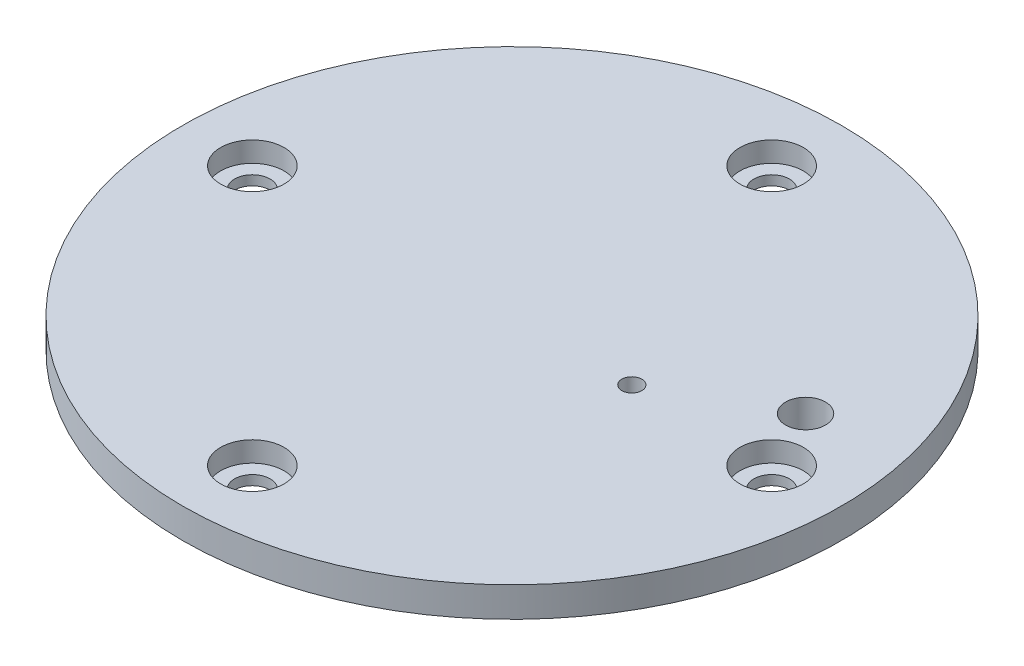
from build123d import *

# Parameters (mm, degrees)
SKETCH1_R                                      = 16.5
BOSS_EXTRUDE1_DEPTH                            = 1.5
CBORE_FOR_0_SOCKET_HEAD_CAP_SCREW1_D           = 1.778
CBORE_FOR_0_SOCKET_HEAD_CAP_SCREW1_CBORE_D     = 3.175
CBORE_FOR_0_SOCKET_HEAD_CAP_SCREW1_CBORE_DEPTH = 1.016
CIRPATTERN1_COUNT                              = 4
SKETCH15_R                                     = 0.5
CUT_EXTRUDE1_DEPTH                             = 1.5
CUT_EXTRUDE2_DEPTH                             = 24.382685902
CUT_EXTRUDE2_DEPTH_BACK                        = 24.382685902
SKETCH16_R                                     = 1


with BuildPart() as part:
    # Sketch1 → Boss-Extrude1 (new body)
    with BuildSketch(Plane(origin=(0, 0, 0), x_dir=(1, 0, 0), z_dir=(0, 1, 0))):
        with Locations(Location((0, 0, 0), (0, 0, 270))):
            Circle(SKETCH1_R)
    extrude(amount=BOSS_EXTRUDE1_DEPTH)

    # CBORE for #0 Socket Head Cap Screw1 (through all)
    with Locations(Plane(origin=(0, 1.5, 0), x_dir=(1, 0, 0), z_dir=(0, 1, 0))):
        with Locations((-13, 0)):
            cbore_for_0_socket_head_cap_screw1 = CounterBoreHole(CBORE_FOR_0_SOCKET_HEAD_CAP_SCREW1_D / 2, CBORE_FOR_0_SOCKET_HEAD_CAP_SCREW1_CBORE_D / 2, CBORE_FOR_0_SOCKET_HEAD_CAP_SCREW1_CBORE_DEPTH)

    # CirPattern1: CBORE for #0 Socket Head Cap Screw1 ×4 about axis
    cirpattern1_axis = Axis((0, 0, 0), (0, 1, 0))
    for i in range(1, CIRPATTERN1_COUNT):
        add(cbore_for_0_socket_head_cap_screw1.rotate(cirpattern1_axis, i * 360 / CIRPATTERN1_COUNT), mode=Mode.SUBTRACT)

    # Sketch15 → Cut-Extrude1 (cut)
    with BuildSketch(Plane.XZ):
        with Locations(Location((6, 0, 0), (0, 0, 270))):
            Circle(SKETCH15_R)
    extrude(amount=-CUT_EXTRUDE1_DEPTH, mode=Mode.SUBTRACT)

    # Sketch16 → Cut-Extrude2 (cut, two sides: drawn at the far end of the back side and taken through both)
    with BuildSketch(Plane(origin=(0, 1.5, 0), x_dir=(1, 0, 0), z_dir=(0, 1, 0)).offset(-CUT_EXTRUDE2_DEPTH_BACK)):
        with Locations(Location((11.591109915, 3.105828541, 0), (0, 0, 270))):
            Circle(SKETCH16_R)
    extrude(amount=CUT_EXTRUDE2_DEPTH + CUT_EXTRUDE2_DEPTH_BACK, mode=Mode.SUBTRACT)


solid = part.part
